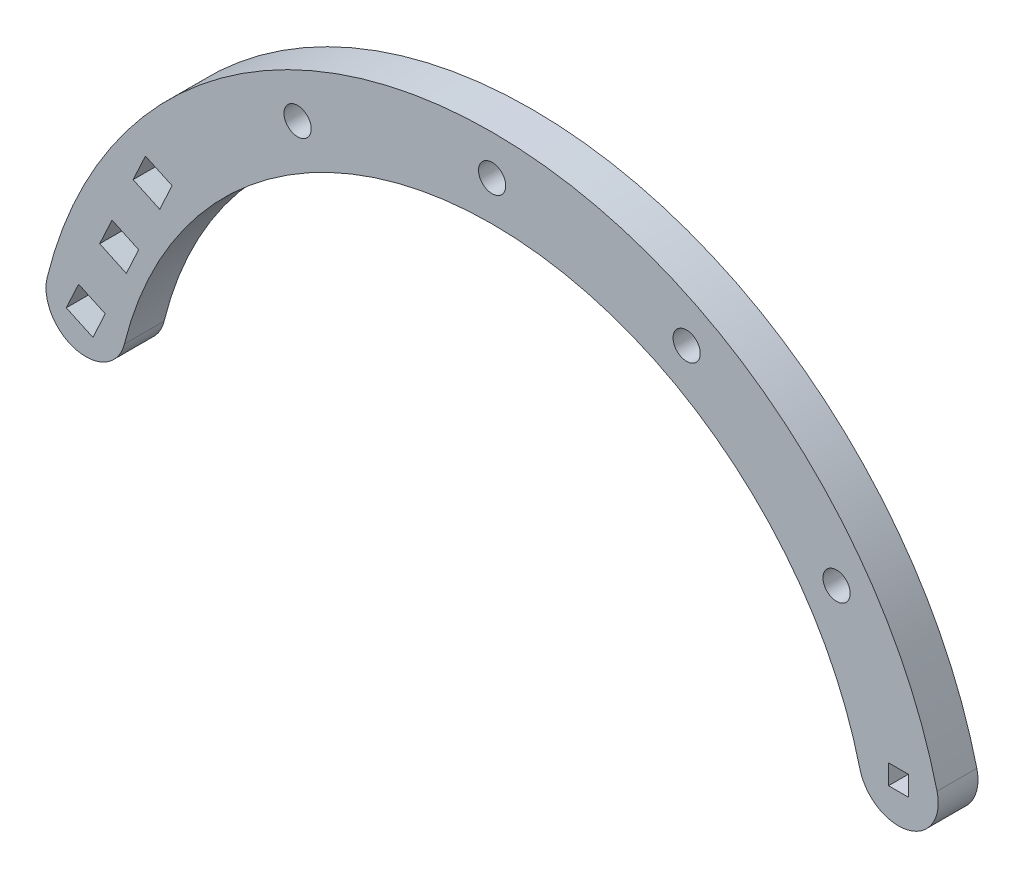
from build123d import *

# Parameters (mm, degrees)
SKETCH2_W           = 3.175
SKETCH2_H           = 3.175
BOSS_EXTRUDE1_DEPTH = 6.35
SKETCH5_R           = 2.1717
CUT_EXTRUDE1_DEPTH  = 25.4


with BuildPart() as part:
    # Sketch2 → Boss-Extrude1 (new body)
    with BuildSketch(Plane.XY):
        with BuildLine():
            ThreePointArc((135.933103671, 1.523612314), (64.8843, 57.15), (-6.164503671, 1.523612314))
            ThreePointArc((-6.164503671, 1.523612314), (-1.523612314, -6.164503671), (6.164503671, -1.523612314))
            ThreePointArc((6.164503671, -1.523612314), (64.8843, 44.45), (123.604096329, -1.523612314))
            ThreePointArc((123.604096329, -1.523612314), (131.292212314, -6.164503671), (135.933103671, 1.523612314))
        make_face()
        Polygon((-1.142495341, 3.111345083), (3.111345083, 1.142495341), (1.142495341, -3.111345083), (-3.111345083, -1.142495341), align=None, mode=Mode.SUBTRACT)
        with Locations((129.7686, 0)):
            Rectangle(SKETCH2_W, SKETCH2_H, mode=Mode.SUBTRACT)
        Polygon((4.191911882, 14.636713109), (2.223061999, 10.38287238), (6.476902727, 8.414022496), (8.445752611, 12.667863225), align=None, mode=Mode.SUBTRACT)
        Polygon((9.526319716, 26.162080852), (7.55746908, 21.9082401), (11.811310114, 19.939390075), (13.780159857, 24.193230498), align=None, mode=Mode.SUBTRACT)
    extrude(amount=BOSS_EXTRUDE1_DEPTH)

    # Sketch5 → Cut-Extrude1 (cut)
    with BuildSketch(Plane(origin=(0, 0, 0), x_dir=(-1, 0, 0), z_dir=(0, 0, -1))):
        with Locations((-64.8843, 50.8)):
            Circle(SKETCH5_R)
        with Locations((-33.823719996, 43.144254616)):
            Circle(SKETCH5_R)
        with Locations((-119.889855449, 21.93085747)):
            Circle(SKETCH5_R)
        with Locations((-95.944880004, 43.144254616)):
            Circle(SKETCH5_R)
    extrude(amount=-CUT_EXTRUDE1_DEPTH, mode=Mode.SUBTRACT)


solid = part.part
